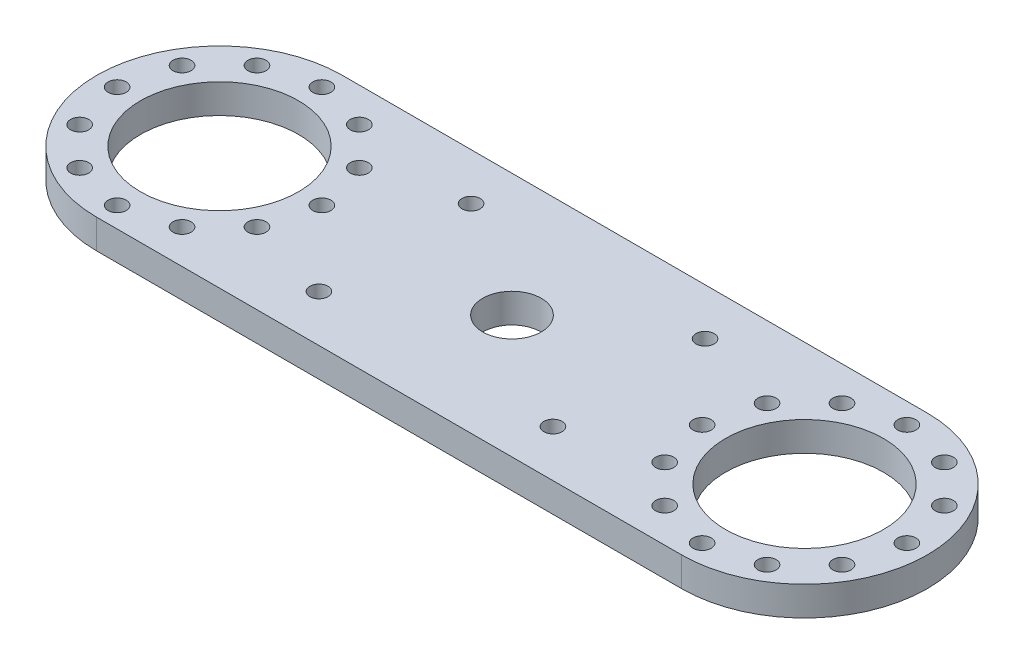
from build123d import *

# Parameters (mm, degrees)
SKETCH_1_R          = 13.5
SKETCH_1_R_2        = 1.55
EXTRUDE_1_DEPTH     = 5
SKETCH_2_R          = 5
CUT_EXTRUDE_1_DEPTH = 5


with BuildPart() as part:
    # 草图1 → 凸台-拉伸1 (new body)
    with BuildSketch(Plane(origin=(0, 0, 0), x_dir=(1, 0, 0), z_dir=(0, 1, 0))):
        with BuildLine():
            Line((-50, 21), (50, 21))
            ThreePointArc((50, 21), (71, 0), (50, -21))
            Line((50, -21), (-50, -21))
            ThreePointArc((-50, -21), (-71, 0), (-50, 21))
        make_face()
        with Locations(Location((-50, 0, 0), (0, 0, 270))):
            Circle(SKETCH_1_R, mode=Mode.SUBTRACT)
        with Locations(Location((-50, 17.5, 0), (0, 0, 270))):
            Circle(SKETCH_1_R_2, mode=Mode.SUBTRACT)
        with Locations(Location((-20, 13, 0), (0, 0, 270))):
            Circle(SKETCH_1_R_2, mode=Mode.SUBTRACT)
        with Locations(Location((-20, -13, 0), (0, 0, 270))):
            Circle(SKETCH_1_R_2, mode=Mode.SUBTRACT)
        with Locations(Location((-41.25, 15.155444566, 0), (0, 0, 270))):
            Circle(SKETCH_1_R_2, mode=Mode.SUBTRACT)
        with Locations(Location((-34.844555434, 8.75, 0), (0, 0, 270))):
            Circle(SKETCH_1_R_2, mode=Mode.SUBTRACT)
        with Locations(Location((-32.5, 0, 0), (0, 0, 270))):
            Circle(SKETCH_1_R_2, mode=Mode.SUBTRACT)
        with Locations(Location((-34.844555434, -8.75, 0), (0, 0, 270))):
            Circle(SKETCH_1_R_2, mode=Mode.SUBTRACT)
        with Locations(Location((-41.25, -15.155444566, 0), (0, 0, 270))):
            Circle(SKETCH_1_R_2, mode=Mode.SUBTRACT)
        with Locations(Location((-50, -17.5, 0), (0, 0, 270))):
            Circle(SKETCH_1_R_2, mode=Mode.SUBTRACT)
        with Locations(Location((-58.75, -15.155444566, 0), (0, 0, 270))):
            Circle(SKETCH_1_R_2, mode=Mode.SUBTRACT)
        with Locations(Location((-65.155444566, -8.75, 0), (0, 0, 270))):
            Circle(SKETCH_1_R_2, mode=Mode.SUBTRACT)
        with Locations(Location((-67.5, 0, 0), (0, 0, 270))):
            Circle(SKETCH_1_R_2, mode=Mode.SUBTRACT)
        with Locations(Location((-65.155444566, 8.75, 0), (0, 0, 270))):
            Circle(SKETCH_1_R_2, mode=Mode.SUBTRACT)
        with Locations(Location((-58.75, 15.155444566, 0), (0, 0, 270))):
            Circle(SKETCH_1_R_2, mode=Mode.SUBTRACT)
        with Locations(Location((58.75, 15.155444566, 0), (0, 0, 90))):
            Circle(SKETCH_1_R_2, mode=Mode.SUBTRACT)
        with Locations(Location((65.155444566, 8.75, 0), (0, 0, 90))):
            Circle(SKETCH_1_R_2, mode=Mode.SUBTRACT)
        with Locations(Location((67.5, 0, 0), (0, 0, 90))):
            Circle(SKETCH_1_R_2, mode=Mode.SUBTRACT)
        with Locations(Location((65.155444566, -8.75, 0), (0, 0, 90))):
            Circle(SKETCH_1_R_2, mode=Mode.SUBTRACT)
        with Locations(Location((58.75, -15.155444566, 0), (0, 0, 90))):
            Circle(SKETCH_1_R_2, mode=Mode.SUBTRACT)
        with Locations(Location((50, -17.5, 0), (0, 0, 90))):
            Circle(SKETCH_1_R_2, mode=Mode.SUBTRACT)
        with Locations(Location((41.25, -15.155444566, 0), (0, 0, 90))):
            Circle(SKETCH_1_R_2, mode=Mode.SUBTRACT)
        with Locations(Location((34.844555434, -8.75, 0), (0, 0, 90))):
            Circle(SKETCH_1_R_2, mode=Mode.SUBTRACT)
        with Locations(Location((32.5, 0, 0), (0, 0, 90))):
            Circle(SKETCH_1_R_2, mode=Mode.SUBTRACT)
        with Locations(Location((41.25, 15.155444566, 0), (0, 0, 90))):
            Circle(SKETCH_1_R_2, mode=Mode.SUBTRACT)
        with Locations(Location((20, -13, 0), (0, 0, 90))):
            Circle(SKETCH_1_R_2, mode=Mode.SUBTRACT)
        with Locations(Location((20, 13, 0), (0, 0, 90))):
            Circle(SKETCH_1_R_2, mode=Mode.SUBTRACT)
        with Locations(Location((50, 17.5, 0), (0, 0, 90))):
            Circle(SKETCH_1_R_2, mode=Mode.SUBTRACT)
        with Locations(Location((50, 0, 0), (0, 0, 90))):
            Circle(SKETCH_1_R, mode=Mode.SUBTRACT)
        with Locations(Location((34.844555434, 8.75, 0), (0, 0, 90))):
            Circle(SKETCH_1_R_2, mode=Mode.SUBTRACT)
    extrude(amount=EXTRUDE_1_DEPTH)

    # 草图2 → 切除-拉伸1 (cut)
    with BuildSketch(Plane(origin=(0, 5, 0), x_dir=(1, 0, 0), z_dir=(0, 1, 0))):
        with Locations(Location((0, 0, 0), (0, 0, 270))):
            Circle(SKETCH_2_R)
    extrude(amount=-CUT_EXTRUDE_1_DEPTH, mode=Mode.SUBTRACT)


solid = part.part
